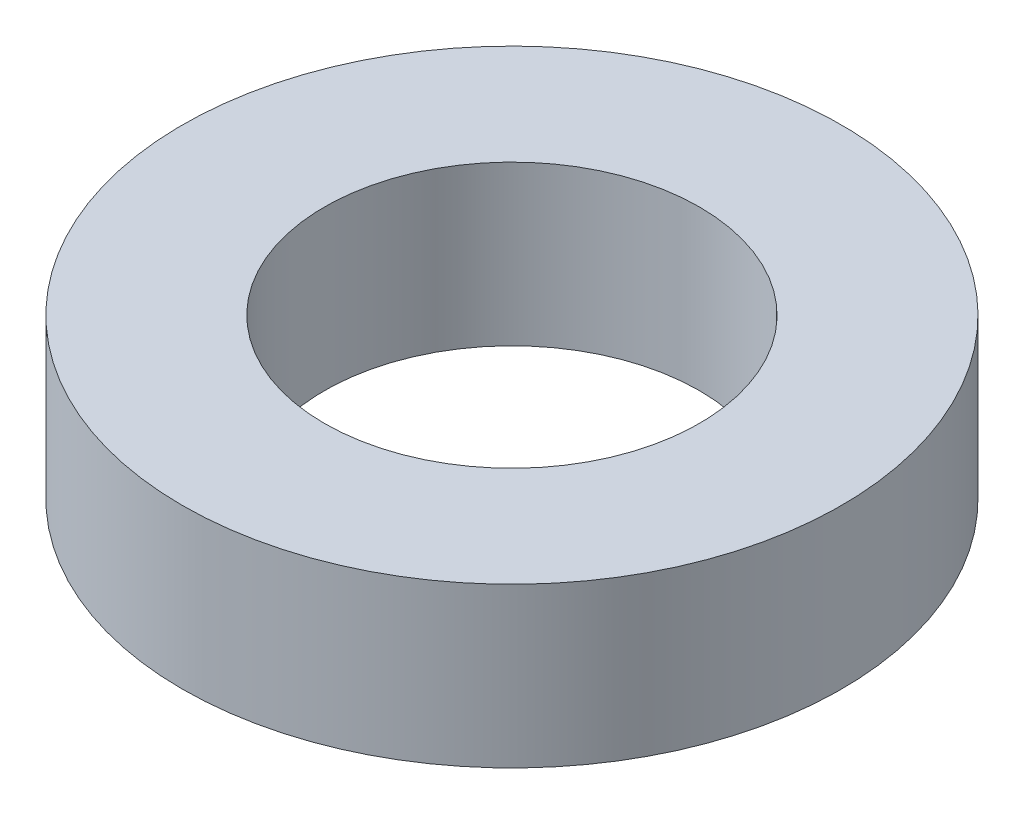
from build123d import *

# Parameters (mm, degrees)
SKETCH_1_R      = 2.9
SKETCH_1_R_2    = 1.65
EXTRUDE_1_DEPTH = 1.4


with BuildPart() as part:
    # Эскиз1 → Бобышка-Вытянуть1 (new body)
    with BuildSketch(Plane(origin=(0, 0, 0), x_dir=(1, 0, 0), z_dir=(0, 1, 0))):
        with Locations(Location((0, 0, 0), (0, 0, 270))):
            Circle(SKETCH_1_R)
        with Locations(Location((0, 0, 0), (0, 0, 270))):
            Circle(SKETCH_1_R_2, mode=Mode.SUBTRACT)
    extrude(amount=EXTRUDE_1_DEPTH)


solid = part.part
